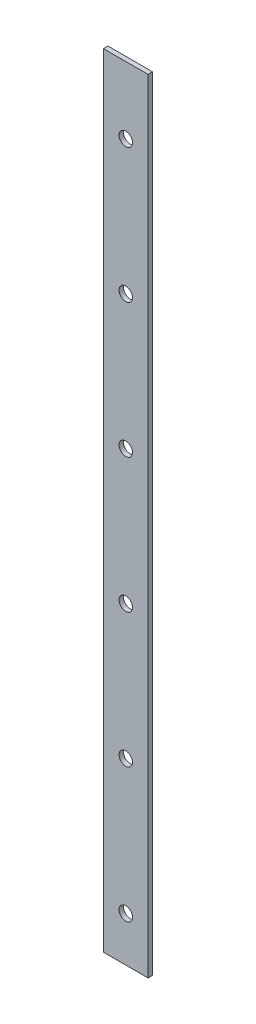
from build123d import *

# Parameters (mm, degrees)
SKIZZE1_W                       = 20
SKIZZE1_H                       = 350
AUFSATZ_LINEAR_AUSTRAGEN1_DEPTH = 2
SKIZZE2_R                       = 3
SCHNITT_LINEAR_AUSTRAGEN1_DEPTH = 10
LINEARES_MUSTER1_COUNT          = 6
LINEARES_MUSTER1_PITCH          = 60


with BuildPart() as part:
    # Skizze1 → Aufsatz-Linear austragen1 (new body)
    with BuildSketch(Plane.XY):
        with Locations((0, 175)):
            Rectangle(SKIZZE1_W, SKIZZE1_H)
    extrude(amount=AUFSATZ_LINEAR_AUSTRAGEN1_DEPTH)

    # Skizze2 → Schnitt-Linear austragen1 (cut)
    with BuildSketch(Plane.XY.offset(2)):
        with Locations((0, 20)):
            Circle(SKIZZE2_R)
    schnitt_linear_austragen1 = extrude(amount=-SCHNITT_LINEAR_AUSTRAGEN1_DEPTH, mode=Mode.SUBTRACT)

    # Lineares Muster1: Schnitt-Linear austragen1 ×6
    with Locations(*[(0, i * LINEARES_MUSTER1_PITCH, 0) for i in range(1, LINEARES_MUSTER1_COUNT)]):
        add(schnitt_linear_austragen1, mode=Mode.SUBTRACT)


solid = part.part
